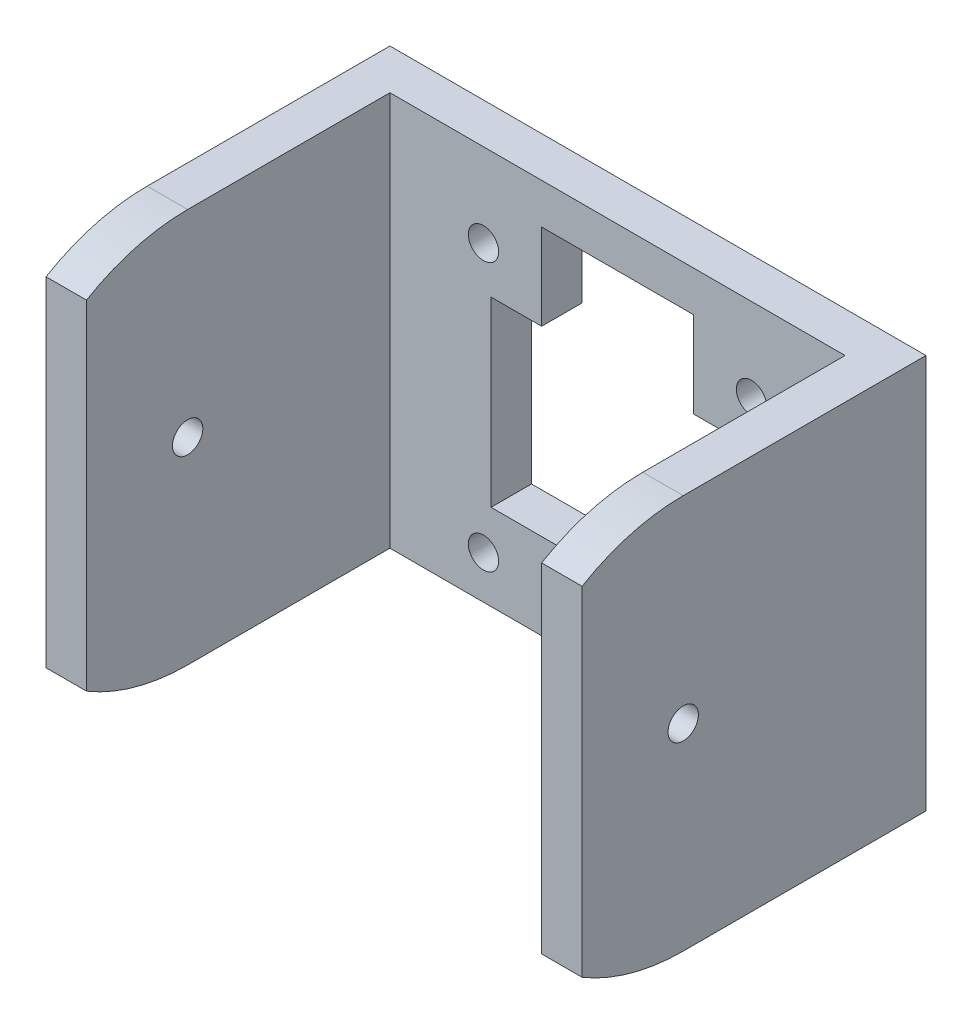
from build123d import *

# Parameters (mm, degrees)
SKETCH_1_W          = 35
SKETCH_1_H          = 35
SKETCH_1_R          = 1.5
SKETCH_1_W_2        = 25
SKETCH_1_H_2        = 18
EXTRUDE_2_DEPTH     = 4
SKETCH_2_W          = 15
SKETCH_2_H          = 9
CUT_EXTRUDE_1_DEPTH = 4
SKETCH_3_W          = 35
SKETCH_3_H          = 4
EXTRUDE_3_DEPTH     = 4
SKETCH_4_W          = 4
SKETCH_4_H          = 39
EXTRUDE_4_DEPTH     = 9
SKETCH_5_W          = 4
SKETCH_5_H          = 39
EXTRUDE_5_DEPTH     = 9
SKETCH_6_W          = 4
SKETCH_6_H          = 39
EXTRUDE_6_DEPTH     = 30
CUT_EXTRUDE_2_REACH = 80.946
SKETCH_7_R          = 1.5
CUT_EXTRUDE_3_REACH = 80.946


with BuildPart() as part:
    # 草图1 → 凸台-拉伸2 (new body)
    with BuildSketch(Plane.XY):
        with Locations((-93.185913744, 26.117851257)):
            Rectangle(SKETCH_1_W, SKETCH_1_H)
        with Locations((-106.435913744, 39.367851257)):
            Circle(SKETCH_1_R, mode=Mode.SUBTRACT)
        with Locations(Location((-79.935913744, 12.867851257, 0), (0, 0, 180))):
            Circle(SKETCH_1_R, mode=Mode.SUBTRACT)
        with Locations((-79.935913744, 39.367851257)):
            Circle(SKETCH_1_R, mode=Mode.SUBTRACT)
        with Locations(Location((-106.435913744, 12.867851257, 0), (0, 0, 180))):
            Circle(SKETCH_1_R, mode=Mode.SUBTRACT)
        with Locations((-93.185913744, 26.117851257)):
            Rectangle(SKETCH_1_W_2, SKETCH_1_H_2, mode=Mode.SUBTRACT)
    extrude(amount=EXTRUDE_2_DEPTH)

    # 草图2 → 切除-拉伸1 (cut)
    with BuildSketch(Plane.XY.offset(4)):
        with Locations((-93.185913744, 39.117851257)):
            Rectangle(SKETCH_2_W, SKETCH_2_H)
    extrude(amount=-CUT_EXTRUDE_1_DEPTH, mode=Mode.SUBTRACT)

    # 草图3 → 凸台-拉伸3 (add)
    with BuildSketch(Plane(origin=(0, 43.617851257, 0), x_dir=(1, 0, 0), z_dir=(0, 1, 0))):
        with Locations((-93.185913744, -2)):
            Rectangle(SKETCH_3_W, SKETCH_3_H)
    extrude(amount=EXTRUDE_3_DEPTH)

    # 草图4 → 凸台-拉伸4 (add)
    with BuildSketch(Plane(origin=(-75.685913744, 0, 0), x_dir=(0, 0, -1), z_dir=(1, 0, 0))):
        with Locations((-2, 28.117851257)):
            Rectangle(SKETCH_4_W, SKETCH_4_H)
    extrude(amount=EXTRUDE_4_DEPTH)

    # 草图5 → 凸台-拉伸5 (add)
    with BuildSketch(Plane.ZY.offset(110.685913744)):
        with Locations((2, 28.117851257)):
            Rectangle(SKETCH_5_W, SKETCH_5_H)
    extrude(amount=EXTRUDE_5_DEPTH)

    # 草图6 → 凸台-拉伸6 (add)
    with BuildSketch(Plane.XY.offset(4)):
        with Locations((-117.685913744, 28.117851257)):
            Rectangle(SKETCH_6_W, SKETCH_6_H)
        with Locations((-68.685913744, 28.117851257)):
            Rectangle(SKETCH_6_W, SKETCH_6_H)
    extrude(amount=EXTRUDE_6_DEPTH)

    # 切除-拉伸2: up to this face of the body (flat: up to its plane)
    cut_extrude_2_end = Plane(part.part.faces().sort_by_distance((-66.685913744, 28.117851257, 17))[0])
    # 草图7 → 切除-拉伸2 (cut, up to the picked face)
    with BuildSketch(Plane.ZY.offset(119.685913744), mode=Mode.PRIVATE) as cut_extrude_2_sk1:
        with Locations(Location((24, 28.117851257, 0), (0, 0, 90))):
            Circle(SKETCH_7_R)
    cut_extrude_2_tool1 = split(extrude(cut_extrude_2_sk1.sketch, amount=-CUT_EXTRUDE_2_REACH, mode=Mode.PRIVATE), bisect_by=cut_extrude_2_end, keep=Keep.BOTH, mode=Mode.PRIVATE)
    add(cut_extrude_2_tool1.solids().sort_by(Axis((-119.685914, 28.117851, 24), (1, 0, 0)))[0], mode=Mode.SUBTRACT)

    # 切除-拉伸3: up to this face of the body (flat: up to its plane)
    cut_extrude_3_end = Plane(part.part.faces().sort_by_distance((-66.685913744, 28.117851257, 16.962484718))[0])
    # 草图9 → 切除-拉伸3 (cut, up to the picked face)
    with BuildSketch(Plane.ZY.offset(119.685913744), mode=Mode.PRIVATE) as cut_extrude_3_sk1:
        with BuildLine():
            Line((34, 44.8585203), (34, 47.617851257))
            Line((34, 47.617851257), (24, 47.617851257))
            ThreePointArc((24, 47.617851257), (29.186856161, 46.915365007), (34, 44.8585203))
        make_face()
    cut_extrude_3_tool1 = split(extrude(cut_extrude_3_sk1.sketch, amount=-CUT_EXTRUDE_3_REACH, mode=Mode.PRIVATE), bisect_by=cut_extrude_3_end, keep=Keep.BOTH, mode=Mode.PRIVATE)
    # 草图9 → 切除-拉伸3 (cut, up to the picked face)
    with BuildSketch(Plane.ZY.offset(119.685913744), mode=Mode.PRIVATE) as cut_extrude_3_sk2:
        with BuildLine():
            ThreePointArc((34, 11.377182214), (29.186856161, 9.320337507), (24, 8.617851257))
            Line((24, 8.617851257), (34, 8.617851257))
            Line((34, 8.617851257), (34, 11.377182214))
        make_face()
    cut_extrude_3_tool2 = split(extrude(cut_extrude_3_sk2.sketch, amount=-CUT_EXTRUDE_3_REACH, mode=Mode.PRIVATE), bisect_by=cut_extrude_3_end, keep=Keep.BOTH, mode=Mode.PRIVATE)
    add(cut_extrude_3_tool1.solids().sort_by(Axis((-119.685914, 46.80116, 31.536753), (1, 0, 0)))[0], mode=Mode.SUBTRACT)
    add(cut_extrude_3_tool2.solids().sort_by(Axis((-119.685914, 9.434542, 31.536753), (1, 0, 0)))[0], mode=Mode.SUBTRACT)


solid = part.part
